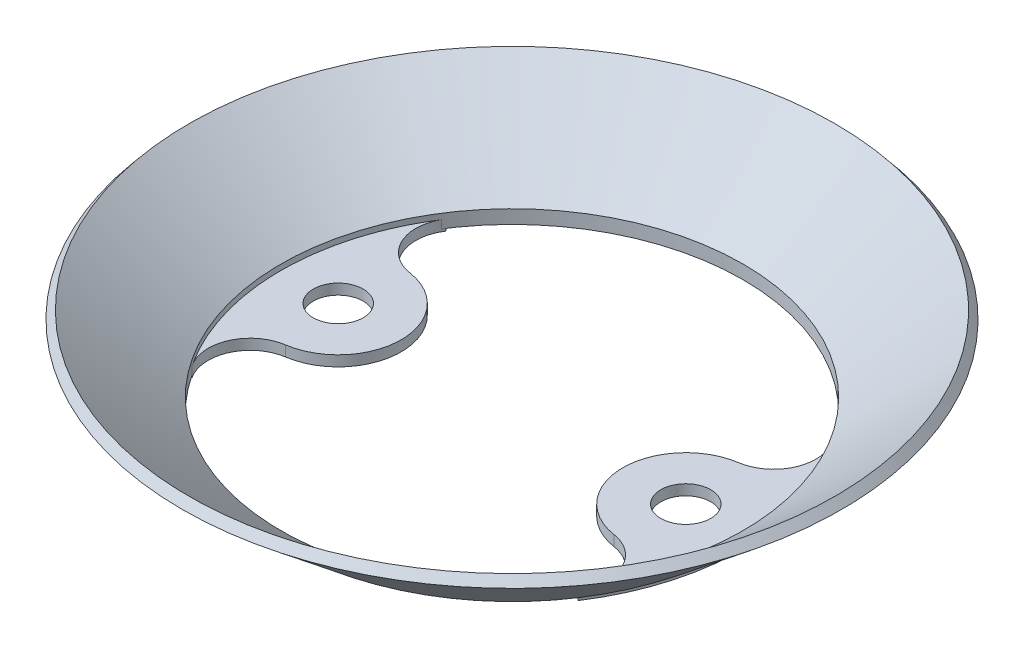
from build123d import *

# Parameters (mm, degrees)
ESQUISSE2_R          = 2.375
BOSS_EXTRU_3_DEPTH   = 1
BOSS_EXTRU_3_2_DEPTH = 1


with BuildPart() as part:
    # Esquisse1 → Révolution1 (revolve)
    with BuildSketch(Plane(origin=(0, 0, 0), x_dir=(0, 0, -1), z_dir=(1, 0, 0)), mode=Mode.PRIVATE) as r_volution1_sk:
        Polygon((-22, -0.767223261), (-31.385641761, 6.960792574), (-30.75, 7.732776739), (-22, 0.528140096), align=None)
    revolve(r_volution1_sk.sketch.rotate(Axis((0, 0, 0), (0, 1, 0)), 180), axis=Axis((0, 0, 0), (0, 1, 0)))


with BuildPart() as body_2:
    # Esquisse2 → Boss.-Extru.3 (new body)
    with BuildSketch(Plane(origin=(0, 0, 0), x_dir=(1, 0, 0), z_dir=(0, 1, 0))):
        with BuildLine():
            ThreePointArc((-15.645422961, -5.931419761), (-10.55, 0), (-15.645422961, 5.931419761))
            ThreePointArc((-15.645422961, 5.931419761), (-18.696321447, 8.258232083), (-18.385120846, 12.082521735))
            ThreePointArc((-18.385120846, 12.082521735), (-22, 0), (-18.385120846, -12.082521735))
            ThreePointArc((-18.385120846, -12.082521735), (-18.696321447, -8.258232083), (-15.645422961, -5.931419761))
        make_face()
        with Locations(Location((-16.55, 0, 0), (0, 0, 270))):
            Circle(ESQUISSE2_R, mode=Mode.SUBTRACT)
    extrude(amount=-BOSS_EXTRU_3_DEPTH)


with BuildPart() as body_3:
    # Esquisse2 → Boss.-Extru.3 2 (new body)
    with BuildSketch(Plane(origin=(0, 0, 0), x_dir=(1, 0, 0), z_dir=(0, 1, 0))):
        with BuildLine():
            ThreePointArc((22, 0), (21.076914606, 6.30584417), (18.385120846, 12.082521735))
            ThreePointArc((18.385120846, 12.082521735), (18.696321447, 8.258232083), (15.645422961, 5.931419761))
            ThreePointArc((15.645422961, 5.931419761), (10.55, 0), (15.645422961, -5.931419761))
            ThreePointArc((15.645422961, -5.931419761), (18.696321447, -8.258232083), (18.385120846, -12.082521735))
            ThreePointArc((18.385120846, -12.082521735), (21.076914606, -6.30584417), (22, 0))
        make_face()
        with Locations(Location((16.55, 0, 0), (0, 0, 270))):
            Circle(ESQUISSE2_R, mode=Mode.SUBTRACT)
    extrude(amount=-BOSS_EXTRU_3_2_DEPTH)


solid = Compound([part.part, body_2.part, body_3.part])
